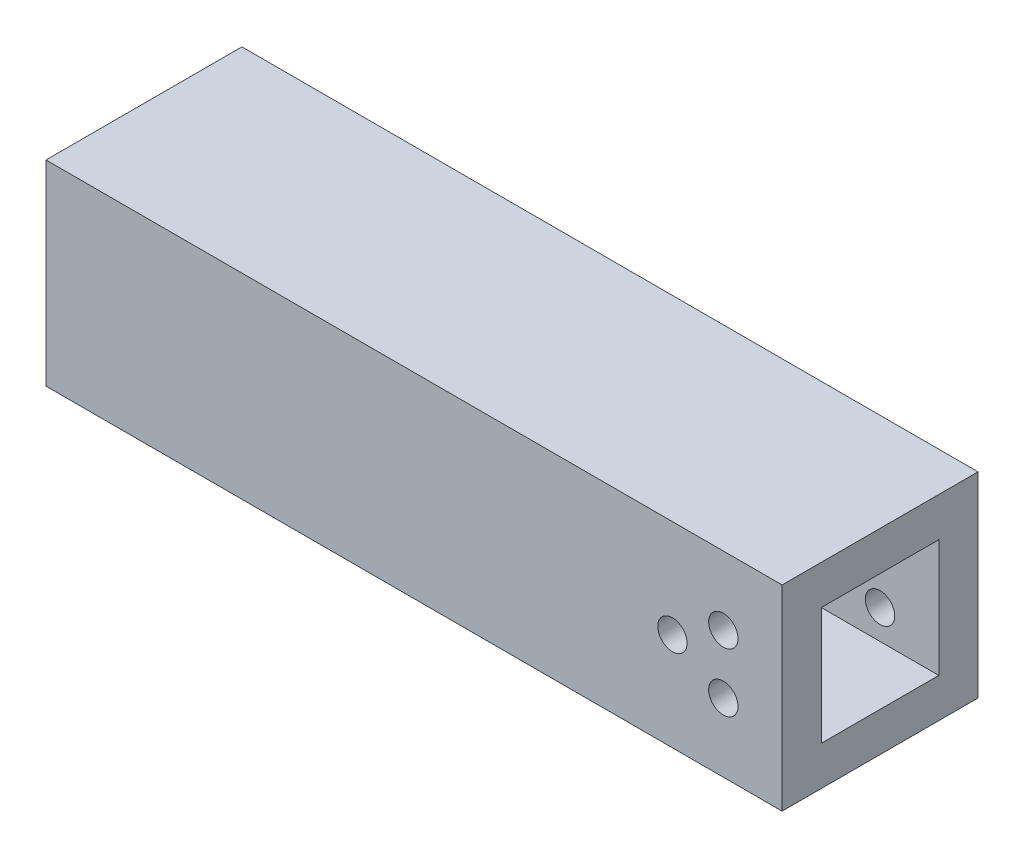
from build123d import *

# Parameters (mm, degrees)
SKETCH1_W                       = 63.5
SKETCH1_H                       = 63.5
SKETCH1_W_2                     = 38.1
SKETCH1_H_2                     = 38.1
BOSS_EXTRUDE1_DEPTH             = 50.8
SKETCH5_W                       = 63.5
SKETCH5_H                       = 63.5
SKETCH5_R                       = 26.9875
BOSS_EXTRUDE2_DEPTH             = 187.8
F_97_0_375_DIAMETER_HOLE2_D     = 9.525
F_97_0_375_DIAMETER_HOLE2_DEPTH = 12.7
F_97_0_375_DIAMETER_HOLE3_D     = 9.525


with BuildPart() as part:
    # Sketch1 → Boss-Extrude1 (new body)
    with BuildSketch(Plane.YZ):
        Rectangle(SKETCH1_W, SKETCH1_H)
        Rectangle(SKETCH1_W_2, SKETCH1_H_2, mode=Mode.SUBTRACT)
    extrude(amount=BOSS_EXTRUDE1_DEPTH)

    # Sketch5 → Boss-Extrude2 (add)
    with BuildSketch(Plane.ZY):
        Rectangle(SKETCH5_W, SKETCH5_H)
        Circle(SKETCH5_R, mode=Mode.SUBTRACT)
    extrude(amount=BOSS_EXTRUDE2_DEPTH)

    # #97 (0.375) Diameter Hole2
    with Locations(Plane(origin=(0, 0, -31.75), x_dir=(-1, 0, 0), z_dir=(0, 0, -1))):
        with Locations((-15.252216058, 0), (-31.75, 9.525), (-31.75, -9.525)):
            Hole(F_97_0_375_DIAMETER_HOLE2_D / 2, depth=F_97_0_375_DIAMETER_HOLE2_DEPTH)

    # #97 (0.375) Diameter Hole3 (through all)
    with Locations(Plane.XY.offset(31.75)):
        with Locations((31.75, -9.525), (31.75, 9.525), (15.252216058, 0)):
            Hole(F_97_0_375_DIAMETER_HOLE3_D / 2)


solid = part.part
